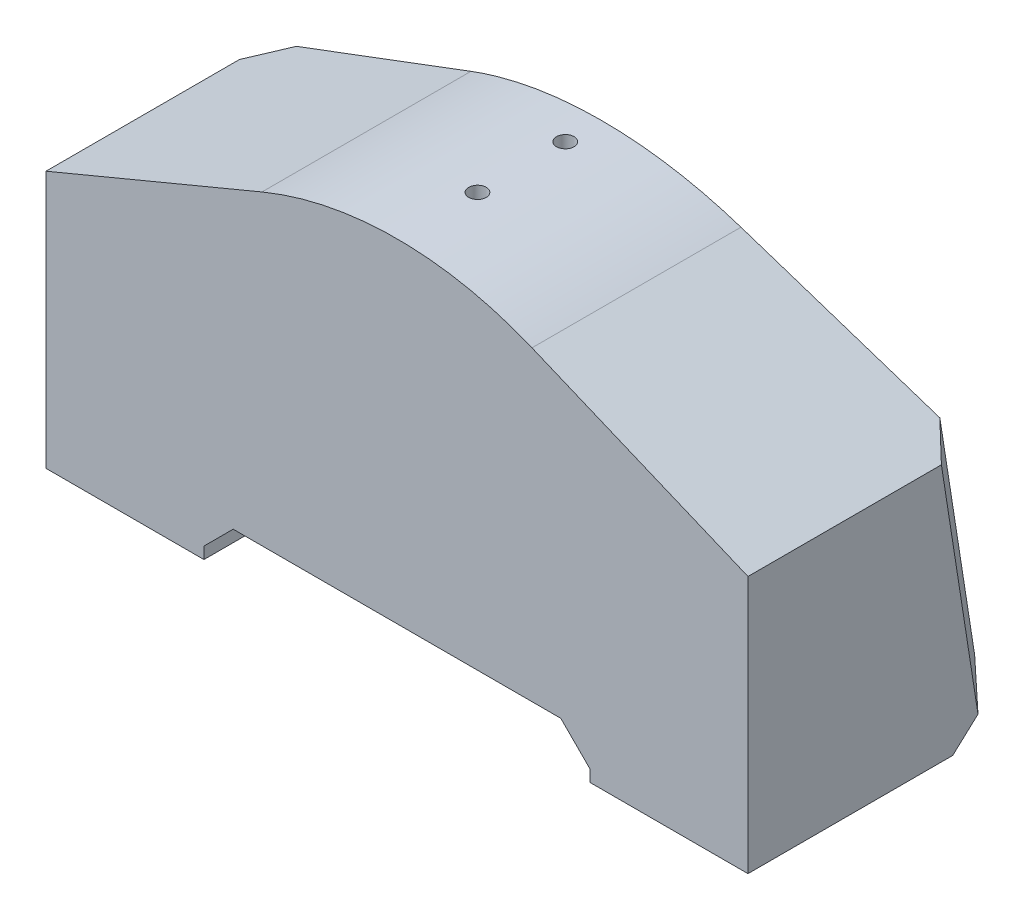
from build123d import *

# Parameters (mm, degrees)
CROQUIS1_W              = 120
CROQUIS1_H              = 45
CROQUIS1_R              = 1.55
SALIENTE_EXTRUIR1_DEPTH = 30
CROQUIS2_W              = 120
CROQUIS2_H              = 45
SALIENTE_EXTRUIR2_DEPTH = 44
SALIENTE_EXTRUIR5_DEPTH = 45
CROQUIS6_R              = 1.55
CORTAR_EXTRUIR2_DEPTH   = 6
CORTAR_EXTRUIR3_DEPTH   = 132.932747906
CHAFL_N1_SIZE           = 5
CROQUIS9_W              = 66
CROQUIS9_H              = 7
CORTAR_EXTRUIR4_DEPTH   = 91.138781721
CHAFL_N2_SIZE           = 5
CORTAR_EXTRUIR6_DEPTH   = 132.932747906
CROQUIS11_R             = 1.5
CORTAR_EXTRUIR7_DEPTH   = 86.762753955


with BuildPart() as part:
    # Croquis1 → Saliente-Extruir1 (new body)
    with BuildSketch(Plane(origin=(0, 0, 0), x_dir=(1, 0, 0), z_dir=(0, 1, 0))):
        Rectangle(CROQUIS1_W, CROQUIS1_H)
        with Locations(Location((-50, -7.5, 0), (0, 0, 270))):
            Circle(CROQUIS1_R, mode=Mode.SUBTRACT)
        with Locations(Location((50, -7.5, 0), (0, 0, 270))):
            Circle(CROQUIS1_R, mode=Mode.SUBTRACT)
    extrude(amount=SALIENTE_EXTRUIR1_DEPTH)

    # Croquis2 → Saliente-Extruir2 (add)
    with BuildSketch(Plane(origin=(0, 30, 0), x_dir=(1, 0, 0), z_dir=(0, 1, 0))):
        Rectangle(CROQUIS2_W, CROQUIS2_H)
    extrude(amount=-SALIENTE_EXTRUIR2_DEPTH)

    # Croquis5 → Saliente-Extruir5 (add, through all)
    with BuildSketch(Plane.XY.offset(22.5)):
        with BuildLine():
            Line((-60, 30), (-23.076922962, 45.384615109))
            ThreePointArc((-23.076922962, 45.384615109), (0, 49.999999701), (23.076922962, 45.384615109))
            Line((23.076922962, 45.384615109), (60, 30))
            Line((60, 30), (-60, 30))
        make_face()
    extrude(amount=-SALIENTE_EXTRUIR5_DEPTH)

    # Croquis6 → Cortar-Extruir2 (cut)
    with BuildSketch(Plane.XZ.offset(14)):
        with Locations(Location((-50, -7.5, 0), (0, 0, 270))):
            Circle(CROQUIS6_R)
        with Locations(Location((50, -7.5, 0), (0, 0, 270))):
            Circle(CROQUIS6_R)
    extrude(amount=-CORTAR_EXTRUIR2_DEPTH, mode=Mode.SUBTRACT)

    # Croquis8 → Cortar-Extruir3 (cut, through all)
    with BuildSketch(Plane.ZY.offset(60)):
        Polygon((-22.5, 30), (-15.624999968, 30), (-12.5, 49.999999701), (-22.5, 49.999999701), align=None)
        Polygon((-22.5, 30), (-22.5, -14), (-15.624999968, 30), align=None)
    extrude(amount=-CORTAR_EXTRUIR3_DEPTH, mode=Mode.SUBTRACT)

    # Chaflán1
    chafl_n1_edges = [part.edges().sort_by_distance(p)[0] for p in [
        (60, 8, -19.062499984),
        (-60, 8, -19.062499984),
    ]]
    chamfer(chafl_n1_edges, length=CHAFL_N1_SIZE)

    # Croquis9 → Cortar-Extruir4 (cut, through all)
    with BuildSketch(Plane.XY.offset(22.5)):
        with Locations((0, -10.5)):
            Rectangle(CROQUIS9_W, CROQUIS9_H)
    extrude(amount=-CORTAR_EXTRUIR4_DEPTH, mode=Mode.SUBTRACT)

    # Chaflán2
    chafl_n2_edges = [part.edges().sort_by_distance(p)[0] for p in [
        (-33, -7, 0.546875003),
        (33, -7, 0.546875003),
    ]]
    chamfer(chafl_n2_edges, length=CHAFL_N2_SIZE)

    # Croquis10 → Cortar-Extruir6 (cut, through all)
    with BuildSketch(Plane.ZY.offset(60)):
        Polygon((-21.249999994, -6), (-12.5, -14), (-22.5, -14), align=None)
    extrude(amount=-CORTAR_EXTRUIR6_DEPTH, mode=Mode.SUBTRACT)

    # Croquis11 → Cortar-Extruir7 (cut, through all)
    with BuildSketch(Plane.XZ.offset(7)):
        with Locations(Location((0, -6.249999994, 0), (0, 0, 270))):
            Circle(CROQUIS11_R)
        with Locations(Location((0, 8.750000006, 0), (0, 0, 270))):
            Circle(CROQUIS11_R)
    extrude(amount=-CORTAR_EXTRUIR7_DEPTH, mode=Mode.SUBTRACT)


solid = part.part
